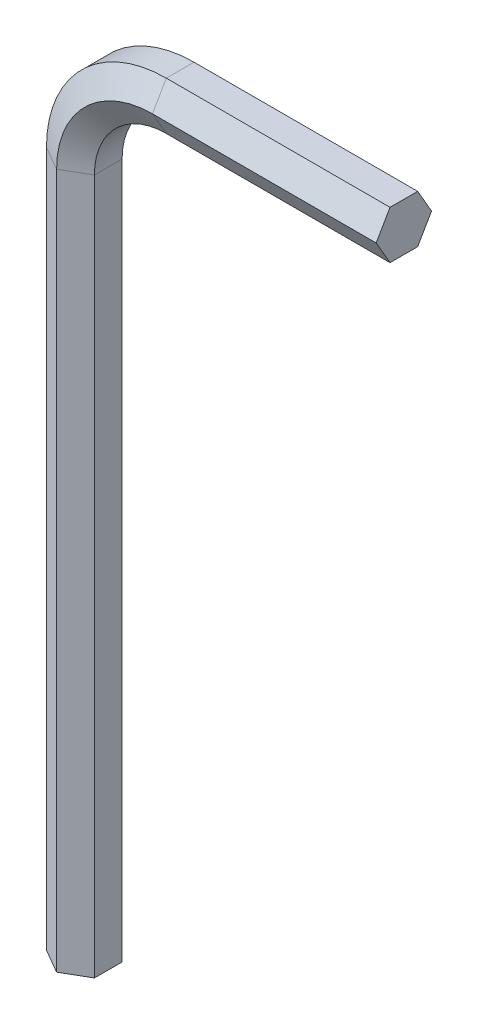
from build123d import *


with BuildPart() as part:
    # Sweep1: sweep along a path in Sketch3
    with BuildLine(Plane.XY) as sweep1_path:
        Line((-31.152910165, -31.735207551), (-31.152910165, 23.532910165))
        ThreePointArc((-31.152910165, 23.532910165), (-28.921063837, 28.921063837), (-23.532910165, 31.152910165))
        Line((-23.532910165, 31.152910165), (-5.752910165, 31.152910165))
    # Sketch5 → Sweep1 (sweep)
    with BuildSketch(Plane(origin=(0, 0, 0), x_dir=(1, 0, 0), z_dir=(0, 1, 0))):
        Polygon((-31.152910165, 2.199704526), (-33.057910165, 1.099852263), (-33.057910165, -1.099852263), (-31.152910165, -2.199704526), (-29.247910165, -1.099852263), (-29.247910165, 1.099852263), align=None)
    sweep(path=sweep1_path.line)


solid = part.part
